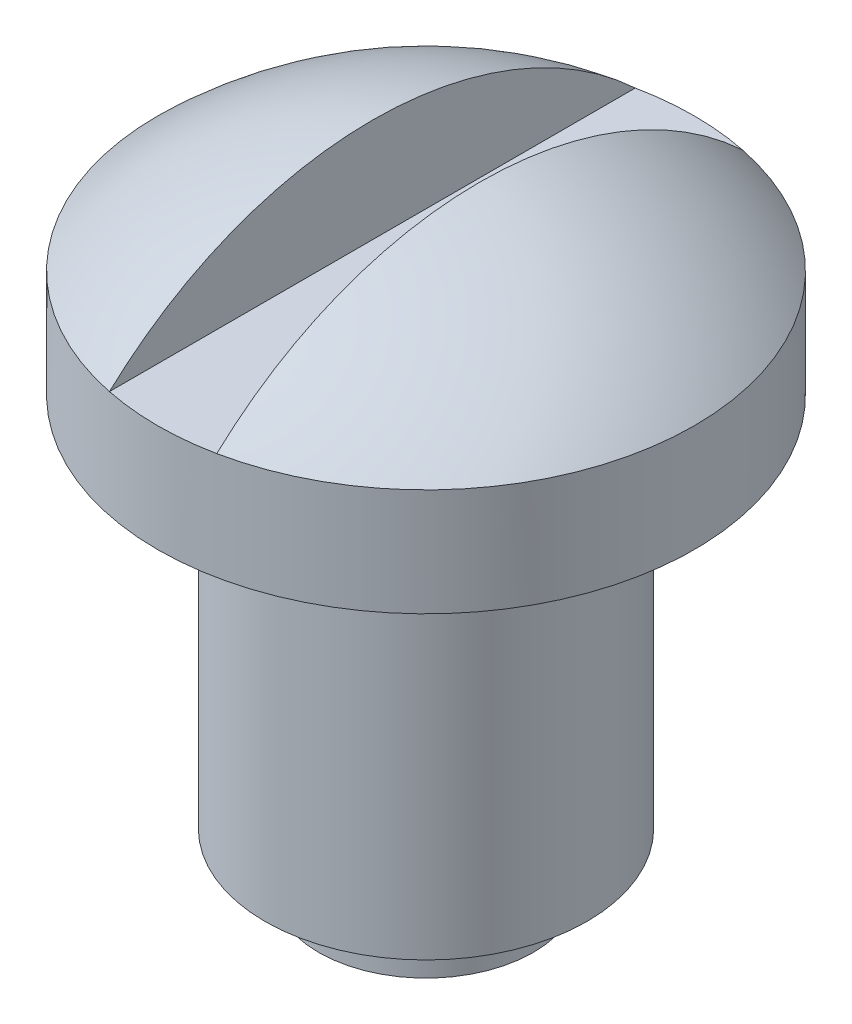
from build123d import *

# Parameters (mm, degrees)
DOME4_FACE_RADIUS = 5
DOME4_HEIGHT      = 2
SKETCH3_W         = 2
SKETCH3_H         = 11.201368044
EXTRUDE3_DEPTH    = 2


with BuildPart() as part:
    # Sketch1 → Revolve3 (revolve)
    with BuildSketch(Plane.XY, mode=Mode.PRIVATE) as revolve3_sk:
        Polygon((0, 0), (-2, 0), (-2, 1), (-3, 1), (-3, 8), (-5, 8), (-5, 10), (0, 10), align=None)
    revolve(revolve3_sk.sketch.rotate(Axis((0, 0, 0), (0, 1, 0)), 270), axis=Axis((0, 0, 0), (0, 1, 0)))

    # Dome4: a dome of height H over a round flat face of radius A is a cap of a sphere of radius (A * A + H * H) / (2 * H)
    dome4_r = (DOME4_FACE_RADIUS * DOME4_FACE_RADIUS + DOME4_HEIGHT * DOME4_HEIGHT) / (2 * DOME4_HEIGHT)
    dome4_base = Plane((0, 10, 0), z_dir=(0, 1, 0))
    with Locations(dome4_base.offset(DOME4_HEIGHT - dome4_r)):
        dome4_ball = Sphere(dome4_r, mode=Mode.PRIVATE)
    add(split(dome4_ball, bisect_by=dome4_base, keep=Keep.TOP, mode=Mode.PRIVATE))

    # Sketch3 → Extrude3 (cut)
    with BuildSketch(Plane(origin=(0, 10, 0), x_dir=(1, 0, 0), z_dir=(0, 1, 0))):
        Rectangle(SKETCH3_W, SKETCH3_H)
    extrude(amount=EXTRUDE3_DEPTH, mode=Mode.SUBTRACT)


solid = part.part
